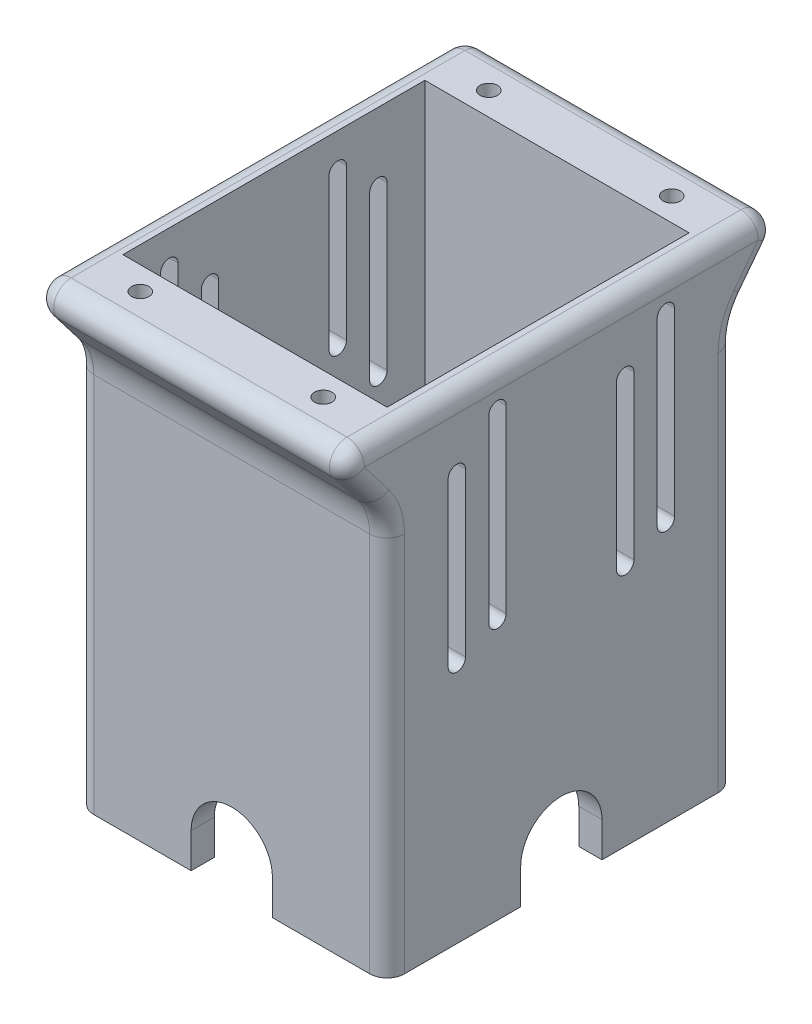
from build123d import *

# Parameters (mm, degrees)
SKETCH1_W           = 53.5
SKETCH1_H           = 60
SKETCH1_W_2         = 45.5
SKETCH1_H_2         = 52
BOSS_EXTRUDE1_DEPTH = 82
CUT_EXTRUDE1_START  = -4
CUT_EXTRUDE1_DEPTH  = 107.40239255
LPATTERN1_COUNT     = 2
LPATTERN1_PITCH     = 29
CUT_EXTRUDE2_DEPTH  = 4
LPATTERN2_COUNT     = 2
LPATTERN2_PITCH     = 29
BOSS_EXTRUDE2_DEPTH = 53.5
FILLET1_R           = 10
FILLET2_R           = 3
SKETCH6_R           = 1.5
CUT_EXTRUDE3_DEPTH  = 9
CUT_EXTRUDE4_DEPTH  = 105.634635656
CUT_EXTRUDE5_DEPTH  = 110.161184183


with BuildPart() as part:
    # Sketch1 → Boss-Extrude1 (new body)
    with BuildSketch(Plane(origin=(0, 0, 0), x_dir=(1, 0, 0), z_dir=(0, 1, 0))):
        Rectangle(SKETCH1_W, SKETCH1_H)
        Rectangle(SKETCH1_W_2, SKETCH1_H_2, mode=Mode.SUBTRACT)
    extrude(amount=BOSS_EXTRUDE1_DEPTH)

    # Sketch3 → Cut-Extrude1 (cut)
    with BuildSketch(Plane.ZY.offset(26.75).offset(CUT_EXTRUDE1_START)):
        with BuildLine():
            Line((19.5, 76), (19.5, 50))
            ThreePointArc((19.5, 50), (18, 48.5), (16.5, 50))
            Line((16.5, 50), (16.5, 76))
            ThreePointArc((16.5, 76), (18, 77.5), (19.5, 76))
        make_face()
        with BuildLine():
            Line((12.5, 70), (12.5, 42))
            ThreePointArc((12.5, 42), (11, 40.5), (9.5, 42))
            Line((9.5, 42), (9.5, 70))
            ThreePointArc((9.5, 70), (11, 71.5), (12.5, 70))
        make_face()
    cut_extrude1 = extrude(amount=CUT_EXTRUDE1_DEPTH, mode=Mode.SUBTRACT)

    # LPattern1: Cut-Extrude1 ×2
    with Locations(*[(0, 0, -i * LPATTERN1_PITCH) for i in range(1, LPATTERN1_COUNT)]):
        add(cut_extrude1, mode=Mode.SUBTRACT)

    # Sketch4 → Cut-Extrude2 (cut)
    with BuildSketch(Plane(origin=(26.75, 0, 0), x_dir=(0, 0, -1), z_dir=(1, 0, 0))):
        with BuildLine():
            Line((-9.5, 76), (-9.5, 45))
            ThreePointArc((-9.5, 45), (-11, 43.5), (-12.5, 45))
            Line((-12.5, 45), (-12.5, 76))
            ThreePointArc((-12.5, 76), (-11, 77.5), (-9.5, 76))
        make_face()
        with BuildLine():
            Line((-16.5, 70), (-16.5, 42))
            ThreePointArc((-16.5, 42), (-18, 40.5), (-19.5, 42))
            Line((-19.5, 42), (-19.5, 70))
            ThreePointArc((-19.5, 70), (-18, 71.5), (-16.5, 70))
        make_face()
    cut_extrude2 = extrude(amount=-CUT_EXTRUDE2_DEPTH, mode=Mode.SUBTRACT)

    # LPattern2: Cut-Extrude2 ×2
    with Locations(*[(0, 0, -i * LPATTERN2_PITCH) for i in range(1, LPATTERN2_COUNT)]):
        add(cut_extrude2, mode=Mode.SUBTRACT)

    # Sketch5 → Boss-Extrude2 (add, through all)
    with BuildSketch(Plane.ZY.offset(26.75)):
        Polygon((30, 82), (30, 69), (40, 82), align=None)
        Polygon((-30, 82), (-30, 69), (-40, 82), align=None)
    extrude(amount=-BOSS_EXTRUDE2_DEPTH)

    # Fillet1
    fillet1_edges = [part.edges().sort_by_distance(p)[0] for p in [
        (0, 69, 30),
        (0, 69, -30),
    ]]
    fillet(fillet1_edges, radius=FILLET1_R)

    # Fillet2
    fillet2_edges = [part.edges().sort_by_distance(p)[0] for p in [
        (-26.75, 82, 0),
        (0, 82, 40),
        (0, 82, -40),
        (26.75, 76.847944071, -36.036880054),
        (-26.75, 76.847944071, -36.036880054),
        (26.75, 32.799390267, 30),
        (-26.75, 32.799390267, 30),
        (-26.75, 76.847944071, 36.036880054),
        (26.75, 76.847944071, 36.036880054),
        (26.75, 32.799390267, -30),
        (-26.75, 32.799390267, -30),
        (-26.75, 68.818842729, 30.532624468),
        (26.75, 68.818842729, 30.532624468),
        (-26.75, 68.818842729, -30.532624468),
        (26.75, 68.818842729, -30.532624468),
        (26.75, 82, 0),
    ]]
    fillet(fillet2_edges, radius=FILLET2_R)

    # Sketch6 → Cut-Extrude3 (cut)
    with BuildSketch(Plane(origin=(0, 82, 0), x_dir=(1, 0, 0), z_dir=(0, 1, 0))):
        with Locations(Location((-15.75, -30, 0), (0, 0, 270))):
            Circle(SKETCH6_R)
        with Locations(Location((15.75, -30, 0), (0, 0, 90))):
            Circle(SKETCH6_R)
    cut_extrude3 = extrude(amount=-CUT_EXTRUDE3_DEPTH, mode=Mode.SUBTRACT)

    # Mirror1: Cut-Extrude3 across plane
    add(cut_extrude3.mirror(Plane.XY), mode=Mode.SUBTRACT)

    # Sketch7 → Cut-Extrude4 (cut, through all)
    with BuildSketch(Plane(origin=(26.75, 0, 0), x_dir=(0, 0, -1), z_dir=(1, 0, 0))):
        with BuildLine():
            Line((7, 0), (7, 6))
            ThreePointArc((7, 6), (0, 13), (-7, 6))
            Line((-7, 6), (-7, 0))
            Line((-7, 0), (7, 0))
        make_face()
    extrude(amount=-CUT_EXTRUDE4_DEPTH, mode=Mode.SUBTRACT)

    # Sketch8 → Cut-Extrude5 (cut, through all)
    with BuildSketch(Plane(origin=(0, 0, -30), x_dir=(-1, 0, 0), z_dir=(0, 0, -1))):
        with BuildLine():
            Line((7, 0), (7, 6))
            ThreePointArc((7, 6), (0, 13), (-7, 6))
            Line((-7, 6), (-7, 0))
            Line((-7, 0), (7, 0))
        make_face()
    extrude(amount=-CUT_EXTRUDE5_DEPTH, mode=Mode.SUBTRACT)


solid = part.part
